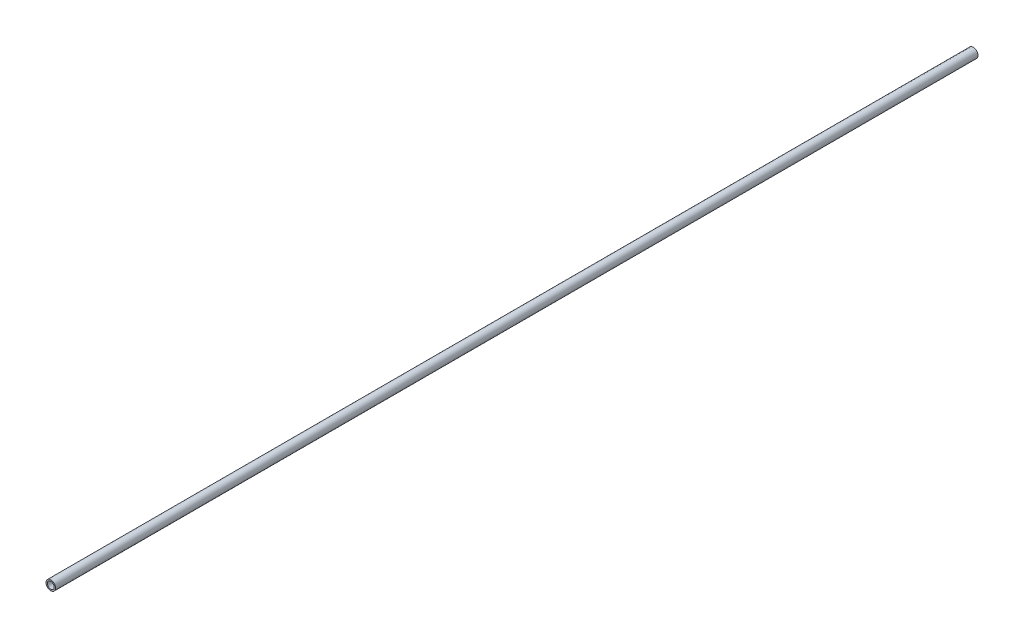
from build123d import *

# Parameters (mm, degrees)
SKETCH2_R           = 1.75
SKETCH2_R_2         = 1.25
BOSS_EXTRUDE1_DEPTH = 340


with BuildPart() as part:
    # Sketch2 → Boss-Extrude1 (new body)
    with BuildSketch(Plane.XY):
        Circle(SKETCH2_R)
        Circle(SKETCH2_R_2, mode=Mode.SUBTRACT)
    extrude(amount=-BOSS_EXTRUDE1_DEPTH)


solid = part.part
